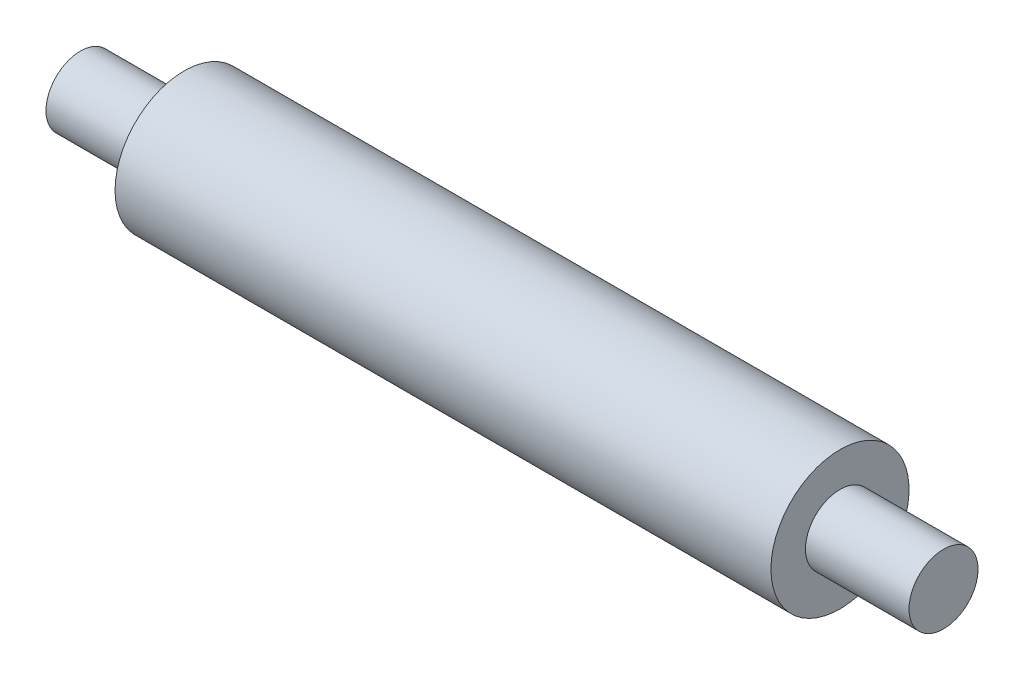
from build123d import *

# Parameters (mm, degrees)
SCALE_1_SCALE = 0.683


with BuildPart() as part:
    # 草图1 → 旋转1 (revolve)
    with BuildSketch(Plane.XY, mode=Mode.PRIVATE) as revolve_1_sk:
        Polygon((-5.356321839, 0), (-5.356321839, -1), (-2.356321839, -1), (-2.356321839, -2), (16.643678161, -2), (16.643678161, -1), (19.643678161, -1), (19.643678161, 0), align=None)
    revolve(revolve_1_sk.sketch.rotate(Axis((-6.022988506, 0, 0), (1, 0, 0)), 270), axis=Axis((-6.022988506, 0, 0), (1, 0, 0)))


with BuildPart() as part_1:
    # 缩放比例1: scaled about (7.143678161, 0, 0)
    add(part.part.scale(SCALE_1_SCALE).moved(Location((2.264545977, 0, 0))))


solid = part_1.part
